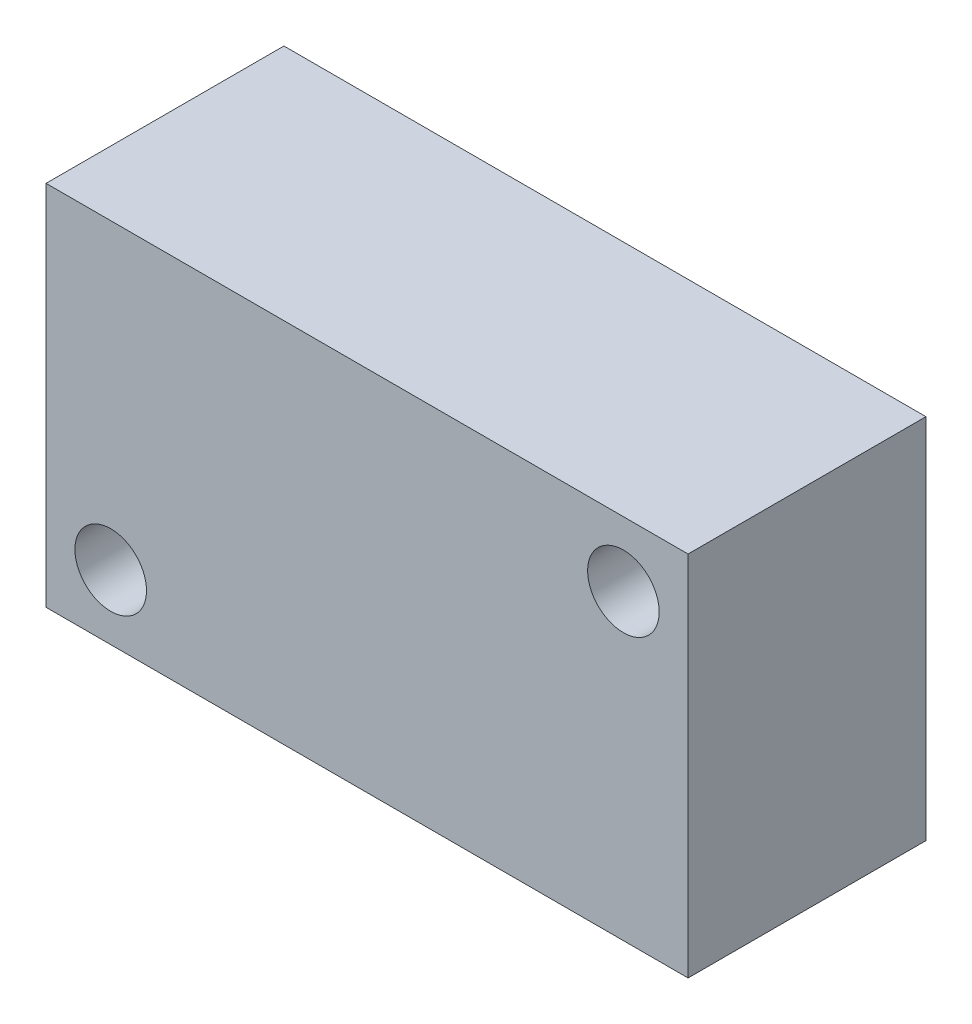
from build123d import *

# Parameters (mm, degrees)
SKETCH_2_W      = 27.8
SKETCH_2_H      = 15.9
SKETCH_2_R      = 1.55
EXTRUDE_1_DEPTH = 10.3


with BuildPart() as part:
    # ｽｹｯﾁ2 → ﾎﾞｽ - 押し出し1 (new body)
    with BuildSketch(Plane.XY):
        with Locations((13.9, 7.95)):
            Rectangle(SKETCH_2_W, SKETCH_2_H)
        with Locations(Location((2.8, 2.8, 0), (0, 0, 180))):
            Circle(SKETCH_2_R, mode=Mode.SUBTRACT)
        with Locations(Location((25, 13.1, 0), (0, 0, 180))):
            Circle(SKETCH_2_R, mode=Mode.SUBTRACT)
    extrude(amount=EXTRUDE_1_DEPTH)


solid = part.part
